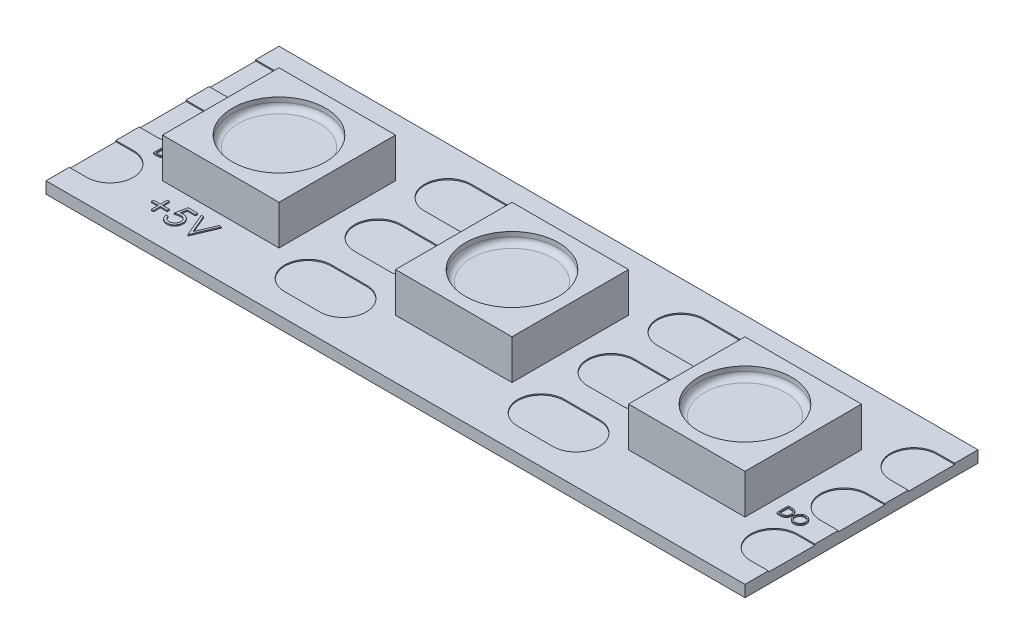
from build123d import *

# Parameters (mm, degrees)
SKETCH1_W           = 30
SKETCH1_H           = 10
BASE_STRIP_DEPTH    = 0.5
SKETCH2_W           = 5
SKETCH2_H           = 5
NEOPIXELS_DEPTH     = 1.7
SKETCH3_R           = 2
NEOPIXEL_LENS_DEPTH = 0.45
FILLET1_R           = 0.25
CUT_EXTRUDE1_DEPTH  = 0.05
SKETCH6_W           = 0.044871795
SKETCH6_H           = 0.5
BOSS_EXTRUDE1_DEPTH = 0.05


with BuildPart() as part:
    # Sketch1 → base Strip (new body)
    with BuildSketch(Plane(origin=(0, 0, 0), x_dir=(1, 0, 0), z_dir=(0, 1, 0))):
        Rectangle(SKETCH1_W, SKETCH1_H)
    extrude(amount=BASE_STRIP_DEPTH)

    # Sketch2 → Neopixels (add)
    with BuildSketch(Plane(origin=(0, 0.5, 0), x_dir=(1, 0, 0), z_dir=(0, 1, 0))):
        with Locations((10, 0)):
            Rectangle(SKETCH2_W, SKETCH2_H)
        Rectangle(SKETCH2_W, SKETCH2_H)
        with Locations((-10, 0)):
            Rectangle(SKETCH2_W, SKETCH2_H)
    extrude(amount=NEOPIXELS_DEPTH)

    # Sketch3 → neopixel lens (cut)
    with BuildSketch(Plane(origin=(0, 2.2, 0), x_dir=(1, 0, 0), z_dir=(0, 1, 0))):
        with Locations(Location((-10, 0, 0), (0, 0, 270))):
            Circle(SKETCH3_R)
        with Locations(Location((0, 0, 0), (0, 0, 270))):
            Circle(SKETCH3_R)
        with Locations(Location((10, 0, 0), (0, 0, 270))):
            Circle(SKETCH3_R)
    extrude(amount=-NEOPIXEL_LENS_DEPTH, mode=Mode.SUBTRACT)

    # Fillet1
    fillet1_edges = [part.edges().sort_by_distance(p)[0] for p in [
        (-10, 1.75, -2),
        (0, 1.75, -2),
        (10, 1.75, -2),
    ]]
    fillet(fillet1_edges, radius=FILLET1_R)

    # Sketch5 → Cut-Extrude1 (cut)
    with BuildSketch(Plane(origin=(0, 0.5, 0), x_dir=(1, 0, 0), z_dir=(0, 1, 0))):
        with BuildLine():
            Line((-5.75, 4), (-4.25, 4))
            ThreePointArc((-4.25, 4), (-3.25, 3), (-4.25, 2))
            Line((-4.25, 2), (-5.75, 2))
            ThreePointArc((-5.75, 2), (-6.75, 3), (-5.75, 4))
        make_face()
        with BuildLine():
            Line((-5.75, -4), (-4.25, -4))
            ThreePointArc((-4.25, -4), (-3.25, -3), (-4.25, -2))
            Line((-4.25, -2), (-5.75, -2))
            ThreePointArc((-5.75, -2), (-6.75, -3), (-5.75, -4))
        make_face()
        with BuildLine():
            Line((-5.75, 1), (-4.25, 1))
            ThreePointArc((-4.25, 1), (-3.25, 0), (-4.25, -1))
            Line((-4.25, -1), (-5.75, -1))
            ThreePointArc((-5.75, -1), (-6.75, 0), (-5.75, 1))
        make_face()
        with BuildLine():
            Line((5.75, -4), (4.25, -4))
            ThreePointArc((4.25, -4), (3.25, -3), (4.25, -2))
            Line((4.25, -2), (5.75, -2))
            ThreePointArc((5.75, -2), (6.75, -3), (5.75, -4))
        make_face()
        with BuildLine():
            Line((5.75, 1), (4.25, 1))
            ThreePointArc((4.25, 1), (3.25, 0), (4.25, -1))
            Line((4.25, -1), (5.75, -1))
            ThreePointArc((5.75, -1), (6.75, 0), (5.75, 1))
        make_face()
        with BuildLine():
            Line((5.75, 4), (4.25, 4))
            ThreePointArc((4.25, 4), (3.25, 3), (4.25, 2))
            Line((4.25, 2), (5.75, 2))
            ThreePointArc((5.75, 2), (6.75, 3), (5.75, 4))
        make_face()
        with BuildLine():
            Line((15, 4), (14.25, 4))
            ThreePointArc((14.25, 4), (13.25, 3), (14.25, 2))
            Line((14.25, 2), (15, 2))
            Line((15, 2), (15, 4))
        make_face()
        with BuildLine():
            Line((15, 1), (14.25, 1))
            ThreePointArc((14.25, 1), (13.25, 0), (14.25, -1))
            Line((14.25, -1), (15, -1))
            Line((15, -1), (15, 1))
        make_face()
        with BuildLine():
            Line((15, -4), (14.25, -4))
            ThreePointArc((14.25, -4), (13.25, -3), (14.25, -2))
            Line((14.25, -2), (15, -2))
            Line((15, -2), (15, -4))
        make_face()
        with BuildLine():
            Line((-15, -4), (-14.25, -4))
            ThreePointArc((-14.25, -4), (-13.25, -3), (-14.25, -2))
            Line((-14.25, -2), (-15, -2))
            Line((-15, -2), (-15, -4))
        make_face()
        with BuildLine():
            Line((-15, 1), (-14.25, 1))
            ThreePointArc((-14.25, 1), (-13.25, 0), (-14.25, -1))
            Line((-14.25, -1), (-15, -1))
            Line((-15, -1), (-15, 1))
        make_face()
        with BuildLine():
            Line((-15, 4), (-14.25, 4))
            ThreePointArc((-14.25, 4), (-13.25, 3), (-14.25, 2))
            Line((-14.25, 2), (-15, 2))
            Line((-15, 2), (-15, 4))
        make_face()
    extrude(amount=-CUT_EXTRUDE1_DEPTH, mode=Mode.SUBTRACT)

    # Sketch6 → Boss-Extrude1 (add)
    # profile 1 of 11: a face of its own
    with BuildSketch(Plane(origin=(0, 0.5, 0), x_dir=(1, 0, 0), z_dir=(0, 1, 0))):
        Polygon((-1, 3.675), (0.1, 3.675), (0.1, 4.1), (1, 3.5), (0.1, 2.9), (0.1, 3.325), (-1, 3.325), align=None)
    # profile 2 of 11: a face of its own
    with BuildSketch(Plane(origin=(0, 0.5, 0), x_dir=(1, 0, 0), z_dir=(0, 1, 0))):
        with BuildLine():
            Line((-10.935897436, 3.829326923), (-11.012820513, 3.756410256))
            add(Edge.make_bspline(
                [(-11.012820513, 3.756410256), (-11.026740195, 3.769504789), (-11.054247637, 3.795381607), (-11.099093421, 3.828956177), (-11.14588303, 3.85771792), (-11.194372315, 3.881119701), (-11.243360473, 3.899791919), (-11.292197267, 3.913085673), (-11.340381753, 3.921563541), (-11.372429529, 3.922577361), (-11.388221154, 3.923076923)],
                knots=[0, 0, 0, 0, 1.08915593, 2.152340314, 3.188132944, 4.216796309, 5.218260357, 6.173443236, 7.099959455, 8, 8, 8, 8], degree=3))
            add(Edge.make_bspline(
                [(-11.388221154, 3.923076923), (-11.397911068, 3.92295875), (-11.417265765, 3.92272271), (-11.446014892, 3.919710077), (-11.474462503, 3.915377259), (-11.502554896, 3.909108151), (-11.530346692, 3.901162706), (-11.557741232, 3.891224002), (-11.584789619, 3.879636789), (-11.611237071, 3.866247511), (-11.636877215, 3.851538983), (-11.661093454, 3.8352394), (-11.684040139, 3.817871175), (-11.705285975, 3.798999466), (-11.724953171, 3.778795219), (-11.743509849, 3.757634274), (-11.760303362, 3.734938498), (-11.775472266, 3.711125462), (-11.789004157, 3.686613408), (-11.800949487, 3.661638268), (-11.810977226, 3.636282881), (-11.818911356, 3.61051543), (-11.825457258, 3.584535261), (-11.830062288, 3.558162484), (-11.832658494, 3.53136886), (-11.833107574, 3.513426786), (-11.833333333, 3.504407051)],
                knots=[0, 0, 0, 0, 1.02818874, 2.053710826, 3.065248034, 4.081641283, 5.106893873, 6.131558223, 7.173050175, 8.228653731, 9.27666206, 10.308777013, 11.325269123, 12.329503258, 13.32196095, 14.316845687, 15.314881793, 16.315733098, 17.311955233, 18.285320748, 19.252783886, 20.203351036, 21.145449891, 22.095197417, 23.042428769, 24, 24, 24, 24], degree=3))
            add(Edge.make_bspline(
                [(-11.833333333, 3.504407051), (-11.833117414, 3.495186818), (-11.832686164, 3.476771528), (-11.829926073, 3.449287507), (-11.824803719, 3.422211678), (-11.817955802, 3.395455069), (-11.809389855, 3.368971855), (-11.79871195, 3.342876852), (-11.786064636, 3.317171026), (-11.771425621, 3.292085993), (-11.75537242, 3.267650843), (-11.737388682, 3.244633837), (-11.718285658, 3.222728472), (-11.697367401, 3.202421111), (-11.675304675, 3.183168569), (-11.65143831, 3.165501277), (-11.626237607, 3.149078928), (-11.599664118, 3.134108494), (-11.57200618, 3.120734626), (-11.543647108, 3.108842085), (-11.514496304, 3.099047988), (-11.484706964, 3.091065673), (-11.4543146, 3.084522731), (-11.423164943, 3.080313451), (-11.391487026, 3.077258927), (-11.370133131, 3.077035593), (-11.359375, 3.076923077)],
                knots=[0, 0, 0, 0, 0.93586088, 1.869166235, 2.799637598, 3.729985548, 4.670839027, 5.622275134, 6.589130586, 7.576015415, 8.568469353, 9.55398029, 10.53834874, 11.515998671, 12.510579167, 13.508179873, 14.527009472, 15.561807829, 16.601455013, 17.643573243, 18.680854198, 19.719860599, 20.772568776, 21.833555941, 22.908541556, 24, 24, 24, 24], degree=3))
            add(Edge.make_bspline(
                [(-11.359375, 3.076923077), (-11.346409758, 3.077194099), (-11.320950399, 3.077726294), (-11.283525701, 3.081869234), (-11.247581966, 3.088339746), (-11.213220194, 3.097815717), (-11.180400474, 3.109902481), (-11.149002491, 3.124472592), (-11.119273445, 3.142084894), (-11.091123967, 3.161963142), (-11.065193343, 3.184110237), (-11.04180645, 3.208008653), (-11.02133631, 3.233542386), (-11.003477825, 3.260561047), (-10.988703923, 3.289288277), (-10.976577411, 3.319583295), (-10.967282184, 3.351459727), (-10.963466477, 3.373485908), (-10.961538462, 3.384615385)],
                knots=[0, 0, 0, 0, 1.13008108, 2.219097802, 3.278683437, 4.311054135, 5.322181354, 6.324827112, 7.324222904, 8.330512327, 9.32562643, 10.293043162, 11.24128371, 12.174520618, 13.111833804, 14.052305215, 15.015860969, 16, 16, 16, 16], degree=3))
            Line((-10.961538462, 3.384615385), (-11.294871795, 3.384615385))
            Line((-11.294871795, 3.384615385), (-11.294871795, 3.487179487))
            Line((-11.294871795, 3.487179487), (-10.871794872, 3.487179487))
            add(Edge.make_bspline(
                [(-10.871794872, 3.487179487), (-10.872282257, 3.468063062), (-10.873236158, 3.430648764), (-10.879927277, 3.37608583), (-10.890731995, 3.32455106), (-10.905492084, 3.275990182), (-10.924599307, 3.230472013), (-10.9478486, 3.187950337), (-10.975612064, 3.148699857), (-11.006900761, 3.112400142), (-11.042015035, 3.080020367), (-11.080006069, 3.051561527), (-11.120936632, 3.027589351), (-11.164768005, 3.008086305), (-11.2113567, 2.992865164), (-11.260810523, 2.982073285), (-11.313062409, 2.975607581), (-11.348872888, 2.974781472), (-11.3671875, 2.974358974)],
                knots=[0, 0, 0, 0, 1.140356446, 2.231883559, 3.274166699, 4.278491846, 5.25512956, 6.21435461, 7.1637429, 8.11826594, 9.068280886, 10.0076534, 10.945064095, 11.891975133, 12.864533718, 13.863980011, 14.907571808, 16, 16, 16, 16], degree=3))
            add(Edge.make_bspline(
                [(-11.3671875, 2.974358974), (-11.37847611, 2.97452158), (-11.400740887, 2.974842292), (-11.43362401, 2.977121534), (-11.465600473, 2.98063027), (-11.496665618, 2.985928877), (-11.526933716, 2.992418778), (-11.556253597, 3.000729269), (-11.584736952, 3.010348898), (-11.612427805, 3.021290519), (-11.639074819, 3.033968135), (-11.664796681, 3.048056603), (-11.689735574, 3.063483278), (-11.713721621, 3.080514948), (-11.736879798, 3.099024222), (-11.759060782, 3.119048199), (-11.780388747, 3.140525662), (-11.79374888, 3.155776807), (-11.800480769, 3.163461538)],
                knots=[0, 0, 0, 0, 1.107784379, 2.184907829, 3.233506516, 4.263428166, 5.276301166, 6.270063455, 7.25232949, 8.225834625, 9.190232166, 10.146266622, 11.1027726, 12.066435141, 13.031522626, 14.010570082, 14.99756817, 16, 16, 16, 16], degree=3))
            add(Edge.make_bspline(
                [(-11.800480769, 3.163461538), (-11.810248178, 3.175653154), (-11.829620868, 3.199834016), (-11.854557484, 3.238576857), (-11.875815028, 3.278691674), (-11.893062977, 3.320290139), (-11.906531001, 3.363333343), (-11.916189931, 3.407766283), (-11.921849156, 3.453646178), (-11.922664453, 3.484693396), (-11.923076923, 3.500400641)],
                knots=[0, 0, 0, 0, 1.023165419, 2.029347347, 3.013907458, 3.994755782, 4.975994455, 5.96558838, 6.970761222, 8, 8, 8, 8], degree=3))
            add(Edge.make_bspline(
                [(-11.923076923, 3.500400641), (-11.922924855, 3.512162428), (-11.922622652, 3.535536515), (-11.918958218, 3.570238603), (-11.91370067, 3.604324515), (-11.905972941, 3.637766388), (-11.896231151, 3.670586558), (-11.884073012, 3.702800262), (-11.869917327, 3.734426511), (-11.853464328, 3.765247616), (-11.835154483, 3.794854591), (-11.815282991, 3.823128249), (-11.793567677, 3.849553696), (-11.770363163, 3.874465596), (-11.745392594, 3.89755098), (-11.718889902, 3.919023583), (-11.690834661, 3.938912208), (-11.661138609, 3.956903589), (-11.630244985, 3.973064624), (-11.598227842, 3.98723297), (-11.565096953, 3.998942489), (-11.531100531, 4.008877854), (-11.495981245, 4.016225037), (-11.459993949, 4.02155325), (-11.42295106, 4.025199136), (-11.397912194, 4.025492352), (-11.385216346, 4.025641026)],
                knots=[0, 0, 0, 0, 1.008945113, 2.00506715, 2.99143336, 3.967273523, 4.948097931, 5.927297278, 6.919902385, 7.919676788, 8.923139349, 9.905703106, 10.883022732, 11.856032218, 12.825136022, 13.798837087, 14.781400844, 15.773989409, 16.776158564, 17.77167057, 18.775803737, 19.789618931, 20.80898985, 21.851988756, 22.910860228, 24, 24, 24, 24], degree=3))
            add(Edge.make_bspline(
                [(-11.385216346, 4.025641026), (-11.374862562, 4.025475457), (-11.354332225, 4.025147153), (-11.323782016, 4.022871539), (-11.293704012, 4.019264716), (-11.264053615, 4.014342777), (-11.234931796, 4.007638865), (-11.206255594, 3.999616498), (-11.177983441, 3.990275977), (-11.150203941, 3.979136307), (-11.122730308, 3.966492414), (-11.095409782, 3.952260008), (-11.068335712, 3.936195721), (-11.041461146, 3.918251853), (-11.014616615, 3.898736591), (-10.988226717, 3.877091784), (-10.961654448, 3.854170997), (-10.944568215, 3.837690373), (-10.935897436, 3.829326923)],
                knots=[0, 0, 0, 0, 0.985871117, 1.954866573, 2.915460327, 3.869826059, 4.81536089, 5.759505086, 6.70452669, 7.649098992, 8.607881297, 9.583363685, 10.581137262, 11.603961102, 12.659522466, 13.73993555, 14.853081303, 16, 16, 16, 16], degree=3))
        make_face()
    # profile 3 of 11: a face of its own
    with BuildSketch(Plane(origin=(0, 0.5, 0), x_dir=(1, 0, 0), z_dir=(0, 1, 0))):
        Polygon((-10.666666667, 3), (-10.666666667, 4), (-10.647836538, 4), (-9.987179487, 3.212940705), (-9.987179487, 4), (-9.897435897, 4), (-9.897435897, 3), (-9.91786859, 3), (-10.576923077, 3.78525641), (-10.576923077, 3), align=None)
    # profile 4 of 11: a face of its own
    with BuildSketch(Plane(origin=(0, 0.5, 0), x_dir=(1, 0, 0), z_dir=(0, 1, 0))):
        with BuildLine():
            Line((-9.641025641, 3), (-9.641025641, 4))
            Line((-9.641025641, 4), (-9.439102564, 4))
            add(Edge.make_bspline(
                [(-9.439102564, 4), (-9.421539996, 3.999873551), (-9.387609206, 3.999629253), (-9.338577078, 3.998080285), (-9.293210289, 3.995340151), (-9.251658043, 3.991348858), (-9.213806269, 3.986447992), (-9.179760952, 3.980305019), (-9.149346054, 3.973051256), (-9.130640499, 3.966866842), (-9.121794872, 3.963942308)],
                knots=[0, 0, 0, 0, 1.314313732, 2.53924729, 3.670748893, 4.714932338, 5.66265055, 6.526160246, 7.303039223, 8, 8, 8, 8], degree=3))
            add(Edge.make_bspline(
                [(-9.121794872, 3.963942308), (-9.110224946, 3.959533535), (-9.087347463, 3.950815965), (-9.054773999, 3.934371307), (-9.02410961, 3.915738993), (-8.995189854, 3.89489446), (-8.968675332, 3.871247504), (-8.943530219, 3.845802622), (-8.920783155, 3.817634525), (-8.899952213, 3.787327385), (-8.881170596, 3.755238228), (-8.864845123, 3.721428197), (-8.851286839, 3.686068994), (-8.840031631, 3.649258952), (-8.831161215, 3.61091713), (-8.825109234, 3.570998882), (-8.821117523, 3.529661971), (-8.820716365, 3.501612124), (-8.820512821, 3.487379808)],
                knots=[0, 0, 0, 0, 0.984719456, 1.947108742, 2.898477687, 3.838006223, 4.779231079, 5.722358779, 6.681677486, 7.655904652, 8.64651281, 9.637519902, 10.640069247, 11.656948941, 12.698408672, 13.768548281, 14.867775369, 16, 16, 16, 16], degree=3))
            add(Edge.make_bspline(
                [(-8.820512821, 3.487379808), (-8.820692526, 3.475019454), (-8.821046653, 3.450662086), (-8.824226458, 3.414764687), (-8.828848263, 3.379932238), (-8.836003748, 3.346330609), (-8.844690181, 3.313665404), (-8.855822795, 3.282284763), (-8.868575794, 3.251900817), (-8.883447188, 3.222924396), (-8.899773298, 3.195472004), (-8.917293796, 3.169593281), (-8.935989995, 3.145657504), (-8.956040176, 3.123592186), (-8.977185238, 3.103430592), (-8.999563618, 3.085004302), (-9.023233061, 3.068673858), (-9.048087553, 3.053797541), (-9.074852161, 3.040820297), (-9.104033837, 3.029840294), (-9.135757031, 3.020741261), (-9.169943876, 3.013149576), (-9.206653441, 3.00712749), (-9.245921717, 3.003091378), (-9.287688371, 3.000361968), (-9.316368161, 3.000122999), (-9.331129808, 3)],
                knots=[0, 0, 0, 0, 1.105936401, 2.179363191, 3.223086493, 4.248585256, 5.251745608, 6.245858792, 7.225916811, 8.198733463, 9.158002045, 10.082870192, 10.993790845, 11.873723703, 12.748670949, 13.606408763, 14.465103618, 15.319838547, 16.196477973, 17.123216899, 18.106603292, 19.147568657, 20.255746949, 21.433717677, 22.679120308, 24, 24, 24, 24], degree=3))
            Line((-9.331129808, 3), (-9.641025641, 3))
        make_face()
        with BuildLine():
            Line((-9.551282051, 3.102564103), (-9.436498397, 3.102564103))
            add(Edge.make_bspline(
                [(-9.436498397, 3.102564103), (-9.420004577, 3.102634987), (-9.388280921, 3.102771324), (-9.34266435, 3.103967668), (-9.300984522, 3.105922507), (-9.26323552, 3.108658244), (-9.229438656, 3.112277848), (-9.199523298, 3.116313535), (-9.17358751, 3.121341378), (-9.157893386, 3.125898795), (-9.150641026, 3.128004808)],
                knots=[0, 0, 0, 0, 1.375205317, 2.645023457, 3.804390687, 4.853969522, 5.800190428, 6.637939096, 7.370582563, 8, 8, 8, 8], degree=3))
            add(Edge.make_bspline(
                [(-9.150641026, 3.128004808), (-9.141512922, 3.131219539), (-9.12347474, 3.137572217), (-9.097508716, 3.14916012), (-9.073292428, 3.162886426), (-9.05040385, 3.178144218), (-9.029167663, 3.195471647), (-9.009332201, 3.21449193), (-8.9909374, 3.235301865), (-8.974173312, 3.257875626), (-8.95917094, 3.28207271), (-8.94617916, 3.307655234), (-8.934793008, 3.334342894), (-8.925856267, 3.362545511), (-8.918851815, 3.392010956), (-8.913890475, 3.422741303), (-8.910800554, 3.454730812), (-8.91044014, 3.476488562), (-8.91025641, 3.487580128)],
                knots=[0, 0, 0, 0, 0.998632004, 1.973411704, 2.929992603, 3.868527914, 4.809262121, 5.754881198, 6.702106254, 7.672490631, 8.653608572, 9.636854334, 10.631411391, 11.644891563, 12.686317036, 13.754757253, 14.855430412, 16, 16, 16, 16], degree=3))
            add(Edge.make_bspline(
                [(-8.91025641, 3.487580128), (-8.910403064, 3.499275408), (-8.910691166, 3.52225089), (-8.914312398, 3.555962517), (-8.919604271, 3.58838556), (-8.927256752, 3.619522187), (-8.937008432, 3.649433145), (-8.94917833, 3.677953005), (-8.963083078, 3.705382967), (-8.979626888, 3.731089929), (-8.997745629, 3.755402246), (-9.017853595, 3.777675079), (-9.03963132, 3.797959165), (-9.062841277, 3.816570397), (-9.088137591, 3.832760019), (-9.11492436, 3.847241927), (-9.143594552, 3.859532182), (-9.163541036, 3.866069), (-9.173677885, 3.869391026)],
                knots=[0, 0, 0, 0, 1.122418816, 2.205001699, 3.251619955, 4.274784885, 5.280384055, 6.268708349, 7.249350384, 8.229342522, 9.199999885, 10.157847722, 11.105861043, 12.055065948, 13.010012805, 13.98527497, 14.976112212, 16, 16, 16, 16], degree=3))
            add(Edge.make_bspline(
                [(-9.173677885, 3.869391026), (-9.182063926, 3.871710005), (-9.199894952, 3.876640791), (-9.228991942, 3.882019469), (-9.261739128, 3.886763612), (-9.298281899, 3.890780195), (-9.338578602, 3.893662286), (-9.382660227, 3.895825519), (-9.430545828, 3.897284557), (-9.463740838, 3.897384188), (-9.480969551, 3.897435897)],
                knots=[0, 0, 0, 0, 0.674548936, 1.434276114, 2.292660221, 3.240891867, 4.284742987, 5.42552168, 6.663806718, 8, 8, 8, 8], degree=3))
            Line((-9.480969551, 3.897435897), (-9.551282051, 3.897435897))
            Line((-9.551282051, 3.897435897), (-9.551282051, 3.102564103))
        make_face(mode=Mode.SUBTRACT)
    # profile 5 of 11: a face of its own
    with BuildSketch(Plane(origin=(0, 0.5, 0), x_dir=(1, 0, 0), z_dir=(0, 1, 0))):
        Polygon((-11.628205128, -3.461538462), (-11.628205128, -3.166666667), (-11.538461538, -3.166666667), (-11.538461538, -3.461538462), (-11.243589744, -3.461538462), (-11.243589744, -3.551282051), (-11.538461538, -3.551282051), (-11.538461538, -3.846153846), (-11.628205128, -3.846153846), (-11.628205128, -3.551282051), (-11.923076923, -3.551282051), (-11.923076923, -3.461538462), align=None)
    # profile 6 of 11: a face of its own
    with BuildSketch(Plane(origin=(0, 0.5, 0), x_dir=(1, 0, 0), z_dir=(0, 1, 0))):
        with BuildLine():
            Line((-10.487179487, -3), (-10.487179487, -3.102564103))
            Line((-10.487179487, -3.102564103), (-10.827323718, -3.102564103))
            Line((-10.827323718, -3.102564103), (-10.881209936, -3.365584936))
            add(Edge.make_bspline(
                [(-10.881209936, -3.365584936), (-10.870622543, -3.362662001), (-10.850111144, -3.356999277), (-10.819836898, -3.350711914), (-10.791096269, -3.346921787), (-10.772446163, -3.34640427), (-10.763421474, -3.346153846)],
                knots=[0, 0, 0, 0, 1.100273476, 2.13160584, 3.095893838, 4, 4, 4, 4], degree=3))
            add(Edge.make_bspline(
                [(-10.763421474, -3.346153846), (-10.752254692, -3.346395542), (-10.730298007, -3.346870777), (-10.698172593, -3.351434162), (-10.667506052, -3.358616995), (-10.638362518, -3.36865143), (-10.610688075, -3.381482782), (-10.584737343, -3.397511336), (-10.560120796, -3.416235145), (-10.537280055, -3.437762292), (-10.516558824, -3.461454182), (-10.49833997, -3.48692786), (-10.482864944, -3.513935763), (-10.470419015, -3.542735937), (-10.460480633, -3.573009981), (-10.453865778, -3.605076433), (-10.449461004, -3.638633039), (-10.448968893, -3.661577202), (-10.448717949, -3.673277244)],
                knots=[0, 0, 0, 0, 1.052922333, 2.070308379, 3.05430497, 4.020497103, 4.973039431, 5.925935799, 6.892292201, 7.88610001, 8.88166317, 9.857072816, 10.836096531, 11.812156883, 12.81219415, 13.836441305, 14.89672472, 16, 16, 16, 16], degree=3))
            add(Edge.make_bspline(
                [(-10.448717949, -3.673277244), (-10.44890797, -3.681426449), (-10.449285445, -3.697614732), (-10.451205042, -3.721655932), (-10.454900961, -3.74518817), (-10.459863167, -3.768214567), (-10.466303858, -3.790691531), (-10.474100731, -3.812683396), (-10.483642453, -3.834053284), (-10.49410856, -3.855003397), (-10.505893268, -3.875060113), (-10.518972842, -3.893816966), (-10.532791554, -3.911555332), (-10.547660521, -3.92808497), (-10.563717948, -3.943297261), (-10.580769367, -3.957282484), (-10.598678715, -3.97027715), (-10.61772307, -3.981753777), (-10.637478065, -3.992314622), (-10.658228985, -4.00097849), (-10.679503471, -4.008724355), (-10.701607721, -4.014898506), (-10.724491667, -4.019736379), (-10.748193032, -4.023022264), (-10.772587509, -4.025415532), (-10.789123227, -4.025565349), (-10.797475962, -4.025641026)],
                knots=[0, 0, 0, 0, 1.056347294, 2.098418968, 3.122841568, 4.141288669, 5.149314143, 6.15115421, 7.162517403, 8.180376062, 9.185164535, 10.17417709, 11.141909838, 12.097768115, 13.052685741, 14.0056014, 14.954263652, 15.917497458, 16.885230207, 17.854509472, 18.828990115, 19.81800267, 20.826176721, 21.857883937, 22.917946725, 24, 24, 24, 24], degree=3))
            add(Edge.make_bspline(
                [(-10.797475962, -4.025641026), (-10.807440013, -4.025443643), (-10.827043108, -4.025055317), (-10.85576327, -4.020992893), (-10.883396014, -4.015174631), (-10.9097189, -4.006421411), (-10.934967833, -3.995453612), (-10.958802895, -3.981591849), (-10.981833117, -3.965883534), (-11.00312227, -3.94734629), (-11.02288116, -3.927084667), (-11.040568734, -3.905096769), (-11.056321184, -3.8817455), (-11.069886255, -3.856917456), (-11.081457118, -3.830677876), (-11.090547114, -3.802928447), (-11.097883787, -3.77381416), (-11.100987622, -3.7537703), (-11.102564103, -3.743589744)],
                knots=[0, 0, 0, 0, 1.0467383, 2.05933395, 3.04377827, 4.011590433, 4.970194871, 5.932262533, 6.905835911, 7.896367577, 8.894135286, 9.877477877, 10.858688626, 11.851381753, 12.8477658, 13.868841284, 14.917554742, 16, 16, 16, 16], degree=3))
            Line((-11.102564103, -3.743589744), (-11.012820513, -3.743589744))
            add(Edge.make_bspline(
                [(-11.012820513, -3.743589744), (-11.010612354, -3.753125873), (-11.006368149, -3.771454843), (-10.997052221, -3.797206655), (-10.985661971, -3.820155004), (-10.972117871, -3.840603457), (-10.955960719, -3.858434599), (-10.93752374, -3.874325188), (-10.916852962, -3.888660939), (-10.893883468, -3.900610301), (-10.869651159, -3.910801374), (-10.844289099, -3.917587572), (-10.818487857, -3.922359256), (-10.801036894, -3.922836902), (-10.792267628, -3.923076923)],
                knots=[0, 0, 0, 0, 1.136247022, 2.183929868, 3.172523383, 4.106158343, 5.02341133, 5.958108904, 6.928429099, 7.938127109, 8.96079061, 9.975095812, 10.982467395, 12, 12, 12, 12], degree=3))
            add(Edge.make_bspline(
                [(-10.792267628, -3.923076923), (-10.783708073, -3.922842415), (-10.766854238, -3.922380667), (-10.742050984, -3.918826664), (-10.718104449, -3.913353072), (-10.695250918, -3.905161685), (-10.673090479, -3.895206051), (-10.652183687, -3.882430315), (-10.631925722, -3.867727452), (-10.612946255, -3.850882701), (-10.595563556, -3.832319931), (-10.580204664, -3.812469247), (-10.56741126, -3.791293005), (-10.556630086, -3.769157819), (-10.548443429, -3.745821088), (-10.542603149, -3.721392181), (-10.539173703, -3.695810758), (-10.538701938, -3.678362384), (-10.538461538, -3.669471154)],
                knots=[0, 0, 0, 0, 1.027316725, 2.022795036, 3.002884548, 3.971462791, 4.93288096, 5.914575861, 6.907176829, 7.935150275, 8.956128384, 9.956726525, 10.942570165, 11.921478529, 12.907843606, 13.90538589, 14.932640048, 16, 16, 16, 16], degree=3))
            add(Edge.make_bspline(
                [(-10.538461538, -3.669471154), (-10.538649675, -3.661449511), (-10.539017927, -3.645748285), (-10.542026661, -3.622777083), (-10.547260082, -3.601041928), (-10.554524048, -3.580437861), (-10.563746764, -3.560945449), (-10.575017139, -3.542544575), (-10.588546681, -3.525477766), (-10.604001507, -3.509737036), (-10.620932375, -3.495209929), (-10.639630588, -3.482825904), (-10.659704852, -3.472407642), (-10.680913309, -3.463416785), (-10.703760423, -3.456959429), (-10.727793747, -3.452111462), (-10.753272806, -3.449307073), (-10.770693003, -3.448917962), (-10.779647436, -3.448717949)],
                knots=[0, 0, 0, 0, 1.045622112, 2.046656509, 3.013763289, 3.955457236, 4.890082067, 5.820317437, 6.762574623, 7.722996705, 8.69280354, 9.665887285, 10.63943826, 11.638615906, 12.663482002, 13.728887084, 14.832589034, 16, 16, 16, 16], degree=3))
            add(Edge.make_bspline(
                [(-10.779647436, -3.448717949), (-10.787398558, -3.448883832), (-10.80340266, -3.449226339), (-10.827952039, -3.451748195), (-10.853749674, -3.455816565), (-10.880696673, -3.461412635), (-10.908873961, -3.4687358), (-10.938222075, -3.477511372), (-10.968802723, -3.488003371), (-10.989407787, -3.495926861), (-11, -3.5)],
                knots=[0, 0, 0, 0, 0.817624296, 1.688186739, 2.600797293, 3.572016777, 4.590301741, 5.671205678, 6.80286297, 8, 8, 8, 8], degree=3))
            Line((-11, -3.5), (-10.897435897, -3))
            Line((-10.897435897, -3), (-10.487179487, -3))
        make_face()
    # profile 7 of 11: a face of its own
    with BuildSketch(Plane(origin=(0, 0.5, 0), x_dir=(1, 0, 0), z_dir=(0, 1, 0))):
        Polygon((-10.333333333, -3), (-10.237179487, -3), (-9.903846154, -3.788060897), (-9.570512821, -3), (-9.474358974, -3), (-9.897435897, -4), (-9.91025641, -4), align=None)
    # profile 8 of 11: a face of its own
    with BuildSketch(Plane(origin=(0, 0.5, 0), x_dir=(1, 0, 0), z_dir=(0, 1, 0))):
        with BuildLine():
            Line((13.064102564, -1.7), (13.064102564, -1.2))
            Line((13.064102564, -1.2), (13.165064103, -1.2))
            add(Edge.make_bspline(
                [(13.165064103, -1.2), (13.173845387, -1.200063224), (13.190810782, -1.200185373), (13.215326846, -1.200959858), (13.23801024, -1.202329924), (13.258786363, -1.204325571), (13.27771225, -1.206776004), (13.294734909, -1.209847491), (13.309942358, -1.213474372), (13.319295135, -1.216566579), (13.323717949, -1.218028846)],
                knots=[0, 0, 0, 0, 1.314313732, 2.53924729, 3.670748893, 4.714932338, 5.66265055, 6.526160246, 7.303039223, 8, 8, 8, 8], degree=3))
            add(Edge.make_bspline(
                [(13.323717949, -1.218028846), (13.329502911, -1.220233233), (13.340941653, -1.224592018), (13.357228385, -1.232814346), (13.37256058, -1.242130504), (13.387020458, -1.25255277), (13.400277718, -1.264376248), (13.412850275, -1.277098689), (13.424223807, -1.291182738), (13.434639278, -1.306336307), (13.444030086, -1.322380886), (13.452192823, -1.339285902), (13.458971965, -1.356965503), (13.464599569, -1.375370524), (13.469034777, -1.394541435), (13.472060767, -1.414500559), (13.474056623, -1.435169014), (13.474257202, -1.449193938), (13.474358974, -1.456310096)],
                knots=[0, 0, 0, 0, 0.984719456, 1.947108742, 2.898477687, 3.838006223, 4.779231079, 5.722358779, 6.681677486, 7.655904652, 8.64651281, 9.637519902, 10.640069247, 11.656948941, 12.698408672, 13.768548281, 14.867775369, 16, 16, 16, 16], degree=3))
            add(Edge.make_bspline(
                [(13.474358974, -1.456310096), (13.474269122, -1.462490273), (13.474092058, -1.474668957), (13.472502156, -1.492617657), (13.470191253, -1.510033881), (13.46661351, -1.526834695), (13.462270294, -1.543167298), (13.456703987, -1.558857619), (13.450327487, -1.574049591), (13.442891791, -1.588537802), (13.434728736, -1.602263998), (13.425968486, -1.615203359), (13.416620387, -1.627171248), (13.406595297, -1.638203907), (13.396022766, -1.648284704), (13.384833576, -1.657497849), (13.372998854, -1.665663071), (13.360571608, -1.673101229), (13.347189304, -1.679589852), (13.332598466, -1.685079853), (13.316736869, -1.68962937), (13.299643447, -1.693425212), (13.281288664, -1.696436255), (13.261654526, -1.698454311), (13.240771199, -1.699819016), (13.226431304, -1.699938501), (13.219050481, -1.7)],
                knots=[0, 0, 0, 0, 1.105936401, 2.179363191, 3.223086493, 4.248585256, 5.251745608, 6.245858792, 7.225916811, 8.198733463, 9.158002045, 10.082870192, 10.993790845, 11.873723703, 12.748670949, 13.606408763, 14.465103618, 15.319838547, 16.196477973, 17.123216899, 18.106603292, 19.147568657, 20.255746949, 21.433717677, 22.679120308, 24, 24, 24, 24], degree=3))
            Line((13.219050481, -1.7), (13.064102564, -1.7))
        make_face()
        with BuildLine():
            Line((13.108974359, -1.648717949), (13.166366186, -1.648717949))
            add(Edge.make_bspline(
                [(13.166366186, -1.648717949), (13.174613096, -1.648682506), (13.190474924, -1.648614338), (13.21328321, -1.648016166), (13.234123123, -1.647038746), (13.252997625, -1.645670878), (13.269896057, -1.643861076), (13.284853735, -1.641843233), (13.297821629, -1.639329311), (13.305668692, -1.637050603), (13.309294872, -1.635997596)],
                knots=[0, 0, 0, 0, 1.375205317, 2.645023457, 3.804390687, 4.853969522, 5.800190428, 6.637939096, 7.370582563, 8, 8, 8, 8], degree=3))
            add(Edge.make_bspline(
                [(13.309294872, -1.635997596), (13.313858924, -1.634390231), (13.322878015, -1.631213892), (13.335861027, -1.62541994), (13.34796917, -1.618556787), (13.35941346, -1.610927891), (13.370031553, -1.602264176), (13.379949284, -1.592754035), (13.389146684, -1.582349067), (13.397528728, -1.571062187), (13.405029915, -1.558963645), (13.411525805, -1.546172383), (13.417218881, -1.532828553), (13.421687251, -1.518727244), (13.425189477, -1.503994522), (13.427670147, -1.488629348), (13.429215108, -1.472634594), (13.429395314, -1.461755719), (13.429487179, -1.456209936)],
                knots=[0, 0, 0, 0, 0.998632004, 1.973411704, 2.929992603, 3.868527914, 4.809262121, 5.754881198, 6.702106254, 7.672490631, 8.653608572, 9.636854334, 10.631411391, 11.644891563, 12.686317036, 13.754757253, 14.855430412, 16, 16, 16, 16], degree=3))
            add(Edge.make_bspline(
                [(13.429487179, -1.456209936), (13.429413853, -1.450362296), (13.429269802, -1.438874555), (13.427459186, -1.422018742), (13.424813249, -1.40580722), (13.420987009, -1.390238906), (13.416111169, -1.375283428), (13.41002622, -1.361023498), (13.403073846, -1.347308516), (13.39480194, -1.334455035), (13.38574257, -1.322298877), (13.375688587, -1.311162461), (13.364799725, -1.301020418), (13.353194746, -1.291714802), (13.340546589, -1.283619991), (13.327153205, -1.276379036), (13.312818109, -1.270233909), (13.302844866, -1.2669655), (13.297776442, -1.265304487)],
                knots=[0, 0, 0, 0, 1.122418816, 2.205001699, 3.251619955, 4.274784885, 5.280384055, 6.268708349, 7.249350384, 8.229342522, 9.199999885, 10.157847722, 11.105861043, 12.055065948, 13.010012805, 13.98527497, 14.976112212, 16, 16, 16, 16], degree=3))
            add(Edge.make_bspline(
                [(13.297776442, -1.265304487), (13.293583421, -1.264144997), (13.284667909, -1.261679604), (13.270119414, -1.258990265), (13.253745821, -1.256618194), (13.235474435, -1.254609903), (13.215326084, -1.253168857), (13.193285271, -1.25208724), (13.16934247, -1.251357722), (13.152744966, -1.251307906), (13.144130609, -1.251282051)],
                knots=[0, 0, 0, 0, 0.674548936, 1.434276114, 2.292660221, 3.240891867, 4.284742987, 5.42552168, 6.663806718, 8, 8, 8, 8], degree=3))
            Line((13.144130609, -1.251282051), (13.108974359, -1.251282051))
            Line((13.108974359, -1.251282051), (13.108974359, -1.648717949))
        make_face(mode=Mode.SUBTRACT)
    # profile 9 of 11: a face of its own
    with BuildSketch(Plane(origin=(0, 0.5, 0), x_dir=(1, 0, 0), z_dir=(0, 1, 0))):
        with BuildLine():
            add(Edge.make_bspline(
                [(13.810897436, -1.187179487), (13.820155737, -1.187413984), (13.838339803, -1.187874556), (13.865064789, -1.191400142), (13.890578374, -1.197499483), (13.915088394, -1.205622767), (13.938301676, -1.216459107), (13.960392946, -1.229556986), (13.981309643, -1.245053623), (14.00076984, -1.262829227), (14.018577976, -1.28216972), (14.034267388, -1.302809421), (14.047416287, -1.324623536), (14.058214257, -1.347546512), (14.066685487, -1.371526507), (14.072531064, -1.396691365), (14.076265086, -1.422878035), (14.076701626, -1.440739015), (14.076923077, -1.449799679)],
                knots=[0, 0, 0, 0, 1.065120563, 2.091984664, 3.0946048, 4.079830382, 5.057816894, 6.036188127, 7.030412546, 8.04752943, 9.064399622, 10.05169764, 11.02544977, 11.989514704, 12.962713494, 13.945757189, 14.957906945, 16, 16, 16, 16], degree=3))
            add(Edge.make_bspline(
                [(14.076923077, -1.449799679), (14.076701658, -1.4587936), (14.076265216, -1.47652166), (14.072526819, -1.502542152), (14.066663819, -1.527555109), (14.058292924, -1.551518774), (14.047546427, -1.574458426), (14.034309974, -1.596313705), (14.018718372, -1.617091776), (14.000974536, -1.636565014), (13.98163153, -1.654421796), (13.960884349, -1.669981635), (13.939199589, -1.683370796), (13.916298202, -1.694054178), (13.892483912, -1.702593023), (13.86754358, -1.708414828), (13.841594072, -1.71217012), (13.823898214, -1.712601336), (13.814903846, -1.712820513)],
                knots=[0, 0, 0, 0, 1.043624062, 2.057103931, 3.04512605, 4.022047818, 4.998200453, 5.980619268, 6.982898556, 8.009068085, 9.034988726, 10.034168286, 11.015286542, 11.987931943, 12.962482838, 13.94673481, 14.956375938, 16, 16, 16, 16], degree=3))
            add(Edge.make_bspline(
                [(13.814903846, -1.712820513), (13.805843229, -1.712599172), (13.787982341, -1.71216285), (13.761762765, -1.708422649), (13.73658023, -1.702573891), (13.712506751, -1.694215401), (13.689528904, -1.683412939), (13.667601749, -1.670240885), (13.6468133, -1.654611293), (13.627335907, -1.636873211), (13.609514593, -1.61756299), (13.59397754, -1.596872382), (13.580802524, -1.575207316), (13.570036333, -1.55250767), (13.561512839, -1.528883178), (13.555697865, -1.504176253), (13.551935586, -1.478527752), (13.551502037, -1.461064481), (13.551282051, -1.452203526)],
                knots=[0, 0, 0, 0, 1.053102029, 2.075944431, 3.073151272, 4.055350789, 5.033113405, 6.020478099, 7.024410459, 8.052272461, 9.079885166, 10.07527673, 11.055994387, 12.023226415, 12.992069828, 13.970394897, 14.97016774, 16, 16, 16, 16], degree=3))
            add(Edge.make_bspline(
                [(13.551282051, -1.452203526), (13.551358428, -1.446256001), (13.551510217, -1.434435984), (13.553337602, -1.416883612), (13.555989273, -1.399613518), (13.559789547, -1.382674812), (13.564759785, -1.366108957), (13.57062436, -1.349801705), (13.577787195, -1.333918316), (13.585884431, -1.318383545), (13.594921832, -1.303439559), (13.604904082, -1.289313904), (13.615480563, -1.275888047), (13.627075333, -1.263509904), (13.639306254, -1.251819382), (13.652371737, -1.240996136), (13.666192057, -1.230942572), (13.680826683, -1.221882523), (13.695915008, -1.213688361), (13.711468834, -1.206656668), (13.727276915, -1.200621517), (13.743413293, -1.19572997), (13.759835118, -1.191868251), (13.77657823, -1.189238629), (13.793629291, -1.187406583), (13.805116622, -1.187255512), (13.810897436, -1.187179487)],
                knots=[0, 0, 0, 0, 1.037015668, 2.060948919, 3.074880161, 4.083647147, 5.086022904, 6.090072063, 7.104153813, 8.122640571, 9.144368836, 10.147691507, 11.138137339, 12.123020368, 13.103399296, 14.087645067, 15.080126199, 16.082011238, 17.087798457, 18.072939717, 19.057185487, 20.037253025, 21.01195951, 21.997135196, 22.992090687, 24, 24, 24, 24], degree=3))
        make_face()
        with BuildLine():
            add(Edge.make_bspline(
                [(13.813100962, -1.238461538), (13.808356014, -1.23851938), (13.798911481, -1.23863451), (13.784870833, -1.240151041), (13.771014842, -1.242312453), (13.757340647, -1.245395528), (13.743905463, -1.249596107), (13.730584057, -1.254430522), (13.717497907, -1.260319249), (13.704690213, -1.266972493), (13.692273774, -1.274336624), (13.680557673, -1.282475448), (13.669511581, -1.291198099), (13.659162543, -1.300524933), (13.649540947, -1.310503447), (13.640457418, -1.320982367), (13.63227605, -1.332261208), (13.62477811, -1.344034124), (13.618068419, -1.356285778), (13.612101939, -1.368887187), (13.607221367, -1.381941142), (13.603241027, -1.395306022), (13.599941054, -1.408960659), (13.597850494, -1.423008637), (13.596317299, -1.437379368), (13.59620875, -1.447091061), (13.596153846, -1.452003205)],
                knots=[0, 0, 0, 0, 1.008559885, 2.007477868, 2.99961109, 3.989939068, 4.984837346, 5.991145699, 7.001802488, 8.033829008, 9.059044045, 10.069351652, 11.065060232, 12.050310815, 13.029377138, 14.011219647, 14.996725999, 15.989392538, 16.977580475, 17.965360261, 18.951710183, 19.937753436, 20.929683414, 21.935841486, 22.955955122, 24, 24, 24, 24], degree=3))
            add(Edge.make_bspline(
                [(13.596153846, -1.452003205), (13.596335969, -1.45922638), (13.596694262, -1.473436598), (13.599831058, -1.494260619), (13.604662768, -1.514273231), (13.611785249, -1.533364932), (13.62069248, -1.55169983), (13.631696321, -1.569115273), (13.644733333, -1.58561597), (13.659542409, -1.601086722), (13.675731367, -1.615207552), (13.692921757, -1.627602324), (13.710929415, -1.638089503), (13.729801301, -1.646633085), (13.749436664, -1.653403047), (13.769962028, -1.658042852), (13.791240665, -1.661096488), (13.805745045, -1.661389739), (13.813100962, -1.661538462)],
                knots=[0, 0, 0, 0, 1.032063989, 2.030389145, 3.003944642, 3.970395727, 4.937377036, 5.913328081, 6.909231446, 7.93887556, 8.970685674, 9.976071282, 10.964166581, 11.944589148, 12.933237628, 13.927779006, 14.949070134, 16, 16, 16, 16], degree=3))
            add(Edge.make_bspline(
                [(13.813100962, -1.661538462), (13.818045176, -1.661470532), (13.827851038, -1.661335808), (13.842436113, -1.659978855), (13.856758429, -1.657802873), (13.870797898, -1.654669922), (13.884538585, -1.650748893), (13.898037842, -1.646090646), (13.911151884, -1.640279045), (13.924046146, -1.63385791), (13.936388467, -1.626537887), (13.948170686, -1.618675294), (13.959095826, -1.609965491), (13.969437122, -1.600777232), (13.97909822, -1.590925254), (13.988013789, -1.580422365), (13.996153808, -1.569202271), (14.0036489, -1.557447213), (14.010335081, -1.545162034), (14.016160666, -1.532514938), (14.021102969, -1.519537065), (14.025092755, -1.506209697), (14.02821925, -1.492558148), (14.030373524, -1.478564136), (14.031880444, -1.464255659), (14.031994026, -1.454577965), (14.032051282, -1.449699519)],
                knots=[0, 0, 0, 0, 1.047197238, 2.076906641, 3.100256066, 4.114471768, 5.12198147, 6.126382909, 7.136867548, 8.15857795, 9.17633901, 10.174870724, 11.156907918, 12.133735059, 13.104061851, 14.077631395, 15.04955518, 16.038496417, 17.029181396, 18.010275684, 18.986308667, 19.968651475, 20.955262928, 21.950658345, 22.966943676, 24, 24, 24, 24], degree=3))
            add(Edge.make_bspline(
                [(14.032051282, -1.449699519), (14.03199398, -1.444854447), (14.031880311, -1.435243354), (14.030374244, -1.421034666), (14.028216974, -1.40714135), (14.025108015, -1.39361795), (14.02110085, -1.380461017), (14.016159803, -1.367682911), (14.010333332, -1.355236026), (14.003646443, -1.343151126), (13.996129896, -1.331554735), (13.987916433, -1.320468676), (13.978864241, -1.310101142), (13.969231951, -1.300196185), (13.958778968, -1.290965058), (13.94755264, -1.282404698), (13.935689257, -1.274308516), (13.923128224, -1.267004864), (13.910164802, -1.260259974), (13.896862808, -1.254481259), (13.883372936, -1.249570956), (13.869729492, -1.245382819), (13.855817638, -1.242324529), (13.841731377, -1.240149093), (13.827490197, -1.238635038), (13.817912594, -1.238519555), (13.813100962, -1.238461538)],
                knots=[0, 0, 0, 0, 1.02996197, 2.043119294, 3.035359645, 4.018872909, 4.991431989, 5.957985074, 6.929999688, 7.912076566, 8.892894881, 9.867085534, 10.843653904, 11.817741046, 12.803660682, 13.806313499, 14.818574707, 15.856120519, 16.894564902, 17.924820532, 18.937903209, 19.946497019, 20.957711757, 21.963978472, 22.977135795, 24, 24, 24, 24], degree=3))
        make_face(mode=Mode.SUBTRACT)
    # profile 10 of 11: a face of its own
    with BuildSketch(Plane(origin=(0, 0.5, 0), x_dir=(1, 0, 0), z_dir=(0, 1, 0))):
        with BuildLine():
            Line((-13.685897436, -1.7), (-13.685897436, -1.2))
            Line((-13.685897436, -1.2), (-13.584935897, -1.2))
            add(Edge.make_bspline(
                [(-13.584935897, -1.2), (-13.576154613, -1.200063224), (-13.559189218, -1.200185373), (-13.534673154, -1.200959858), (-13.51198976, -1.202329924), (-13.491213637, -1.204325571), (-13.47228775, -1.206776004), (-13.455265091, -1.209847491), (-13.440057642, -1.213474372), (-13.430704865, -1.216566579), (-13.426282051, -1.218028846)],
                knots=[0, 0, 0, 0, 1.314313732, 2.53924729, 3.670748893, 4.714932338, 5.66265055, 6.526160246, 7.303039223, 8, 8, 8, 8], degree=3))
            add(Edge.make_bspline(
                [(-13.426282051, -1.218028846), (-13.420497089, -1.220233233), (-13.409058347, -1.224592018), (-13.392771615, -1.232814346), (-13.37743942, -1.242130504), (-13.362979542, -1.25255277), (-13.349722282, -1.264376248), (-13.337149725, -1.277098689), (-13.325776193, -1.291182738), (-13.315360722, -1.306336307), (-13.305969914, -1.322380886), (-13.297807177, -1.339285902), (-13.291028035, -1.356965503), (-13.285400431, -1.375370524), (-13.280965223, -1.394541435), (-13.277939233, -1.414500559), (-13.275943377, -1.435169014), (-13.275742798, -1.449193938), (-13.275641026, -1.456310096)],
                knots=[0, 0, 0, 0, 0.984719456, 1.947108742, 2.898477687, 3.838006223, 4.779231079, 5.722358779, 6.681677486, 7.655904652, 8.64651281, 9.637519902, 10.640069247, 11.656948941, 12.698408672, 13.768548281, 14.867775369, 16, 16, 16, 16], degree=3))
            add(Edge.make_bspline(
                [(-13.275641026, -1.456310096), (-13.275730878, -1.462490273), (-13.275907942, -1.474668957), (-13.277497844, -1.492617657), (-13.279808747, -1.510033881), (-13.28338649, -1.526834695), (-13.287729706, -1.543167298), (-13.293296013, -1.558857619), (-13.299672513, -1.574049591), (-13.307108209, -1.588537802), (-13.315271264, -1.602263998), (-13.324031514, -1.615203359), (-13.333379613, -1.627171248), (-13.343404703, -1.638203907), (-13.353977234, -1.648284704), (-13.365166424, -1.657497849), (-13.377001146, -1.665663071), (-13.389428392, -1.673101229), (-13.402810696, -1.679589852), (-13.417401534, -1.685079853), (-13.433263131, -1.68962937), (-13.450356553, -1.693425212), (-13.468711336, -1.696436255), (-13.488345474, -1.698454311), (-13.509228801, -1.699819016), (-13.523568696, -1.699938501), (-13.530949519, -1.7)],
                knots=[0, 0, 0, 0, 1.105936401, 2.179363191, 3.223086493, 4.248585256, 5.251745608, 6.245858792, 7.225916811, 8.198733463, 9.158002045, 10.082870192, 10.993790845, 11.873723703, 12.748670949, 13.606408763, 14.465103618, 15.319838547, 16.196477973, 17.123216899, 18.106603292, 19.147568657, 20.255746949, 21.433717677, 22.679120308, 24, 24, 24, 24], degree=3))
            Line((-13.530949519, -1.7), (-13.685897436, -1.7))
        make_face()
        with BuildLine():
            Line((-13.641025641, -1.648717949), (-13.583633814, -1.648717949))
            add(Edge.make_bspline(
                [(-13.583633814, -1.648717949), (-13.575386904, -1.648682506), (-13.559525076, -1.648614338), (-13.53671679, -1.648016166), (-13.515876877, -1.647038746), (-13.497002375, -1.645670878), (-13.480103943, -1.643861076), (-13.465146265, -1.641843233), (-13.452178371, -1.639329311), (-13.444331308, -1.637050603), (-13.440705128, -1.635997596)],
                knots=[0, 0, 0, 0, 1.375205317, 2.645023457, 3.804390687, 4.853969522, 5.800190428, 6.637939096, 7.370582563, 8, 8, 8, 8], degree=3))
            add(Edge.make_bspline(
                [(-13.440705128, -1.635997596), (-13.436141076, -1.634390231), (-13.427121985, -1.631213892), (-13.414138973, -1.62541994), (-13.40203083, -1.618556787), (-13.39058654, -1.610927891), (-13.379968447, -1.602264176), (-13.370050716, -1.592754035), (-13.360853316, -1.582349067), (-13.352471272, -1.571062187), (-13.344970085, -1.558963645), (-13.338474195, -1.546172383), (-13.332781119, -1.532828553), (-13.328312749, -1.518727244), (-13.324810523, -1.503994522), (-13.322329853, -1.488629348), (-13.320784892, -1.472634594), (-13.320604686, -1.461755719), (-13.320512821, -1.456209936)],
                knots=[0, 0, 0, 0, 0.998632004, 1.973411704, 2.929992603, 3.868527914, 4.809262121, 5.754881198, 6.702106254, 7.672490631, 8.653608572, 9.636854334, 10.631411391, 11.644891563, 12.686317036, 13.754757253, 14.855430412, 16, 16, 16, 16], degree=3))
            add(Edge.make_bspline(
                [(-13.320512821, -1.456209936), (-13.320586147, -1.450362296), (-13.320730198, -1.438874555), (-13.322540814, -1.422018742), (-13.325186751, -1.40580722), (-13.329012991, -1.390238906), (-13.333888831, -1.375283428), (-13.33997378, -1.361023498), (-13.346926154, -1.347308516), (-13.35519806, -1.334455035), (-13.36425743, -1.322298877), (-13.374311413, -1.311162461), (-13.385200275, -1.301020418), (-13.396805254, -1.291714802), (-13.409453411, -1.283619991), (-13.422846795, -1.276379036), (-13.437181891, -1.270233909), (-13.447155134, -1.2669655), (-13.452223558, -1.265304487)],
                knots=[0, 0, 0, 0, 1.122418816, 2.205001699, 3.251619955, 4.274784885, 5.280384055, 6.268708349, 7.249350384, 8.229342522, 9.199999885, 10.157847722, 11.105861043, 12.055065948, 13.010012805, 13.98527497, 14.976112212, 16, 16, 16, 16], degree=3))
            add(Edge.make_bspline(
                [(-13.452223558, -1.265304487), (-13.456416579, -1.264144997), (-13.465332091, -1.261679604), (-13.479880586, -1.258990265), (-13.496254179, -1.256618194), (-13.514525565, -1.254609903), (-13.534673916, -1.253168857), (-13.556714729, -1.25208724), (-13.58065753, -1.251357722), (-13.597255034, -1.251307906), (-13.605869391, -1.251282051)],
                knots=[0, 0, 0, 0, 0.674548936, 1.434276114, 2.292660221, 3.240891867, 4.284742987, 5.42552168, 6.663806718, 8, 8, 8, 8], degree=3))
            Line((-13.605869391, -1.251282051), (-13.641025641, -1.251282051))
            Line((-13.641025641, -1.251282051), (-13.641025641, -1.648717949))
        make_face(mode=Mode.SUBTRACT)
    # profile 11 of 11: a face of its own
    with BuildSketch(Plane(origin=(0, 0.5, 0), x_dir=(1, 0, 0), z_dir=(0, 1, 0))):
        with Locations((-13.150641026, -1.45)):
            Rectangle(SKETCH6_W, SKETCH6_H)
    extrude(amount=BOSS_EXTRUDE1_DEPTH)


solid = part.part
